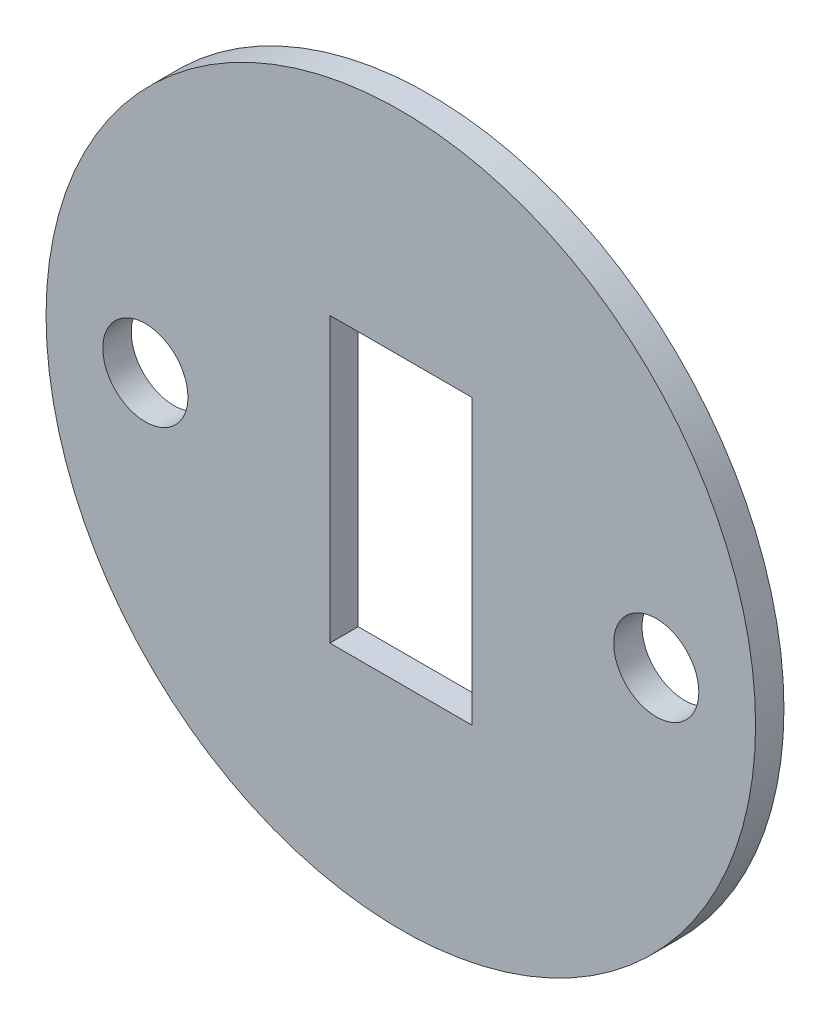
from build123d import *

# Parameters (mm, degrees)
SKETCH1_R           = 25
BOSS_EXTRUDE1_DEPTH = 2
SKETCH2_W           = 10
SKETCH2_H           = 20
CUT_EXTRUDE1_DEPTH  = 5
SKETCH3_R           = 3
CUT_EXTRUDE2_DEPTH  = 5


with BuildPart() as part:
    # Sketch1 → Boss-Extrude1 (new body)
    with BuildSketch(Plane.XY):
        Circle(SKETCH1_R)
    extrude(amount=BOSS_EXTRUDE1_DEPTH)

    # Sketch2 → Cut-Extrude1 (cut)
    with BuildSketch(Plane.XY):
        Rectangle(SKETCH2_W, SKETCH2_H)
    extrude(amount=CUT_EXTRUDE1_DEPTH, mode=Mode.SUBTRACT)

    # Sketch3 → Cut-Extrude2 (cut)
    with BuildSketch(Plane.XY):
        with Locations((-18, 0)):
            Circle(SKETCH3_R)
        with Locations((18, 0)):
            Circle(SKETCH3_R)
    extrude(amount=CUT_EXTRUDE2_DEPTH, mode=Mode.SUBTRACT)


solid = part.part
